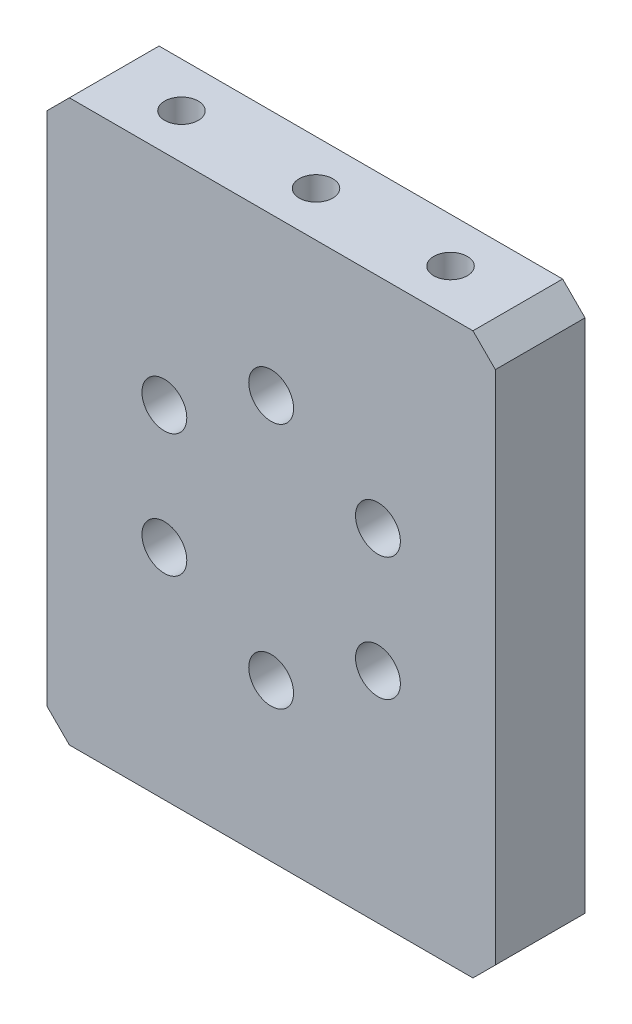
from build123d import *

# Parameters (mm, degrees)
SKETCH_1_W          = 40
SKETCH_1_H          = 50
EXTRUDE_1_DEPTH     = 8
SKETCH_2_R          = 15
CUT_EXTRUDE_1_DEPTH = 4
SKETCH_3_R          = 2
CUT_EXTRUDE_2_DEPTH = 10
CHAMFER_1_SIZE      = 2
SKETCH_4_R          = 1.5
CUT_EXTRUDE_3_DEPTH = 6
CUT_EXTRUDE_START   = -6
SKETCH_5_R          = 1.5
CUT_EXTRUDE_4_DEPTH = 6
CHAMFER_2_SIZE      = 0.5


with BuildPart() as part:
    # 草图1 → 凸台-拉伸1 (new body)
    with BuildSketch(Plane.XY):
        Rectangle(SKETCH_1_W, SKETCH_1_H)
    extrude(amount=EXTRUDE_1_DEPTH)

    # 草图2 → 切除-拉伸1 (cut)
    with BuildSketch(Plane(origin=(0, 0, 0), x_dir=(-1, 0, 0), z_dir=(0, 0, -1))):
        Circle(SKETCH_2_R)
    extrude(amount=-CUT_EXTRUDE_1_DEPTH, mode=Mode.SUBTRACT)

    # 草图3 → 切除-拉伸2 (cut)
    with BuildSketch(Plane(origin=(0, 0, 4), x_dir=(-1, 0, 0), z_dir=(0, 0, -1))):
        with Locations((0, 11)):
            Circle(SKETCH_3_R)
        with Locations((9.526279442, 5.5)):
            Circle(SKETCH_3_R)
        with Locations((9.526279442, -5.5)):
            Circle(SKETCH_3_R)
        with Locations((0, -11)):
            Circle(SKETCH_3_R)
        with Locations((-9.526279442, -5.5)):
            Circle(SKETCH_3_R)
        with Locations((-9.526279442, 5.5)):
            Circle(SKETCH_3_R)
    extrude(amount=-CUT_EXTRUDE_2_DEPTH, mode=Mode.SUBTRACT)

    # 倒角1
    chamfer_1_edges = [part.edges().sort_by_distance(p)[0] for p in [
        (20, -25, 4),
        (-20, -25, 4),
        (-20, 25, 4),
        (20, 25, 4),
    ]]
    chamfer(chamfer_1_edges, length=CHAMFER_1_SIZE)

    # 草图4 → 切除-拉伸3 (cut)
    with BuildSketch(Plane(origin=(0, 25, 0), x_dir=(1, 0, 0), z_dir=(0, 1, 0))):
        with Locations(Location((-12, -4, 0), (0, 0, 270))):
            Circle(SKETCH_4_R)
        with Locations(Location((0, -4, 0), (0, 0, 270))):
            Circle(SKETCH_4_R)
        with Locations(Location((12, -4, 0), (0, 0, 270))):
            Circle(SKETCH_4_R)
    extrude(amount=-CUT_EXTRUDE_3_DEPTH, mode=Mode.SUBTRACT)

    # 草图5 → 切除-拉伸4 (cut)
    with BuildSketch(Plane.XZ.offset(25).offset(CUT_EXTRUDE_START)):
        with Locations(Location((-12, 4, 0), (0, 0, 90))):
            Circle(SKETCH_5_R)
        with Locations(Location((0, 4, 0), (0, 0, 90))):
            Circle(SKETCH_5_R)
        with Locations(Location((12, 4, 0), (0, 0, 90))):
            Circle(SKETCH_5_R)
    extrude(amount=CUT_EXTRUDE_4_DEPTH, mode=Mode.SUBTRACT)

    # 倒角2
    chamfer_2_edges = [part.edges().sort_by_distance(p)[0] for p in [
        (15, 0, 0),
    ]]
    chamfer(chamfer_2_edges, length=CHAMFER_2_SIZE)


solid = part.part
